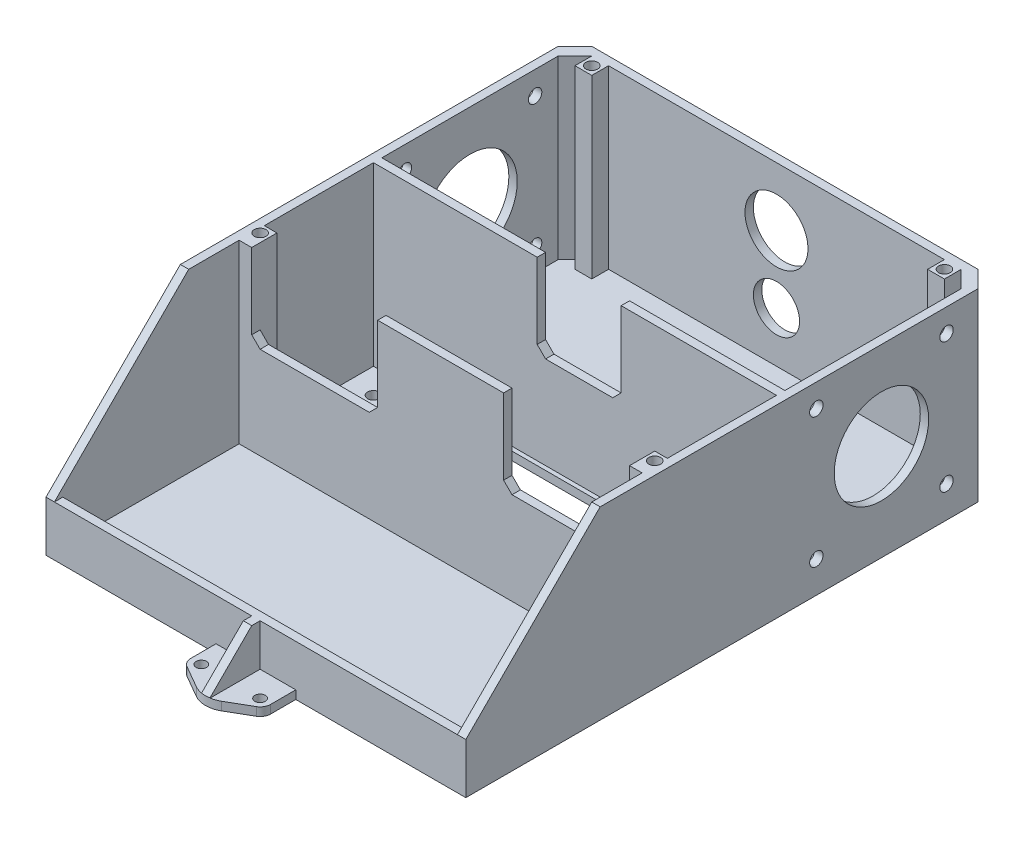
from build123d import *

# Parameters (mm, degrees)
SKETCH1_W               = 100
SKETCH1_H               = 126
BOSS_EXTRUDE1_DEPTH     = 2
SKETCH2_W               = 96
SKETCH2_H               = 2
BOSS_EXTRUDE2_DEPTH     = 42
CHAMFER1_SIZE           = 32
CHAMFER2_SIZE           = 4
CUT_EXTRUDE1_DEPTH      = 166.577776287
CUT_EXTRUDE1_DEPTH_BACK = 166.577776287
SKETCH4_R               = 11.25
SKETCH4_R_2             = 1.6
SKETCH5_R               = 1.4
SKETCH5_W               = 78
SKETCH5_H               = 28
CUT_EXTRUDE2_DEPTH      = 167.252819525
SKETCH6_W               = 96
SKETCH6_H               = 2
BOSS_EXTRUDE3_DEPTH     = 10
SKETCH9_W               = 4
SKETCH9_H               = 4
SKETCH9_W_2             = 3
BOSS_EXTRUDE5_DEPTH     = 42
SKETCH10_R              = 1.4
CUT_EXTRUDE4_DEPTH      = 10
SKETCH11_W              = 30
SKETCH11_H              = 2
SKETCH11_W_2            = 20
CUT_EXTRUDE5_DEPTH      = 20
CHAMFER4_SIZE           = 2
SKETCH12_R              = 5.5
SKETCH12_R_2            = 7.5
CUT_EXTRUDE6_DEPTH      = 2
SKETCH13_W              = 1
SKETCH13_H              = 10
BOSS_EXTRUDE6_DEPTH     = 12
CHAMFER5_SIZE           = 10
SKETCH14_R              = 1.25
CUT_EXTRUDE7_DEPTH      = 2.3


with BuildPart() as part:
    # Sketch1 → Boss-Extrude1 (new body)
    with BuildSketch(Plane(origin=(0, 0, 0), x_dir=(1, 0, 0), z_dir=(0, 1, 0))):
        with Locations((50, 63)):
            Rectangle(SKETCH1_W, SKETCH1_H)
    extrude(amount=BOSS_EXTRUDE1_DEPTH)

    # Sketch2 → Boss-Extrude2 (add)
    with BuildSketch(Plane(origin=(0, 2, 0), x_dir=(1, 0, 0), z_dir=(0, 1, 0))):
        Polygon((0, 126), (0, 0), (2, 0), (2, 44), (2, 46), (2, 76), (2, 78), (2, 124), (98, 124), (98, 78), (98, 76), (98, 46), (98, 44), (98, 0), (100, 0), (100, 126), align=None)
        with Locations((50, 77)):
            Rectangle(SKETCH2_W, SKETCH2_H)
        with Locations((50, 45)):
            Rectangle(SKETCH2_W, SKETCH2_H)
    extrude(amount=BOSS_EXTRUDE2_DEPTH)

    # Chamfer1
    chamfer1_edges = [part.edges().sort_by_distance(p)[0] for p in [
        (99, 44, 0),
        (1, 44, 0),
    ]]
    chamfer(chamfer1_edges, length=CHAMFER1_SIZE)

    # Chamfer2
    chamfer2_edges = [part.edges().sort_by_distance(p)[0] for p in [
        (2, 23, -124),
        (98, 23, -124),
        (0, 22, -126),
        (100, 22, -126),
    ]]
    chamfer(chamfer2_edges, length=CHAMFER2_SIZE)

    # Sketch4 → Cut-Extrude1 (cut, two sides: drawn at the far end of the back side and taken through both)
    with BuildSketch(Plane(origin=(2, 0, 0), x_dir=(0, 0, -1), z_dir=(1, 0, 0)).offset(-CUT_EXTRUDE1_DEPTH_BACK)):
        with Locations((99, 23)):
            Circle(SKETCH4_R)
        with Locations((83.5, 38.5)):
            Circle(SKETCH4_R_2)
        with Locations((114.5, 38.5)):
            Circle(SKETCH4_R_2)
        with Locations((114.5, 7.5)):
            Circle(SKETCH4_R_2)
        with Locations((83.5, 7.5)):
            Circle(SKETCH4_R_2)
    extrude(amount=CUT_EXTRUDE1_DEPTH + CUT_EXTRUDE1_DEPTH_BACK, mode=Mode.SUBTRACT)

    # Sketch5 → Cut-Extrude2 (cut, through all)
    with BuildSketch(Plane(origin=(0, 2, 0), x_dir=(1, 0, 0), z_dir=(0, 1, 0))):
        with Locations(Location((8, 70, 0), (0, 0, 270))):
            Circle(SKETCH5_R)
        with Locations(Location((8, 52, 0), (0, 0, 270))):
            Circle(SKETCH5_R)
        with Locations(Location((92, 70, 0), (0, 0, 270))):
            Circle(SKETCH5_R)
        with Locations(Location((92, 52, 0), (0, 0, 270))):
            Circle(SKETCH5_R)
        with Locations((50, 61)):
            Rectangle(SKETCH5_W, SKETCH5_H)
    extrude(amount=-CUT_EXTRUDE2_DEPTH, mode=Mode.SUBTRACT)

    # Sketch6 → Boss-Extrude3 (add)
    with BuildSketch(Plane(origin=(0, 2, 0), x_dir=(1, 0, 0), z_dir=(0, 1, 0))):
        with Locations((50, 1)):
            Rectangle(SKETCH6_W, SKETCH6_H)
    extrude(amount=BOSS_EXTRUDE3_DEPTH)

    # Sketch9 → Boss-Extrude5 (add)
    with BuildSketch(Plane(origin=(0, 2, 0), x_dir=(1, 0, 0), z_dir=(0, 1, 0))):
        with Locations((8, 122)):
            Rectangle(SKETCH9_W, SKETCH9_H)
        with Locations((92, 122)):
            Rectangle(SKETCH9_W, SKETCH9_H)
        with Locations((96.5, 48)):
            Rectangle(SKETCH9_W_2, SKETCH9_H)
        with Locations((3.5, 48)):
            Rectangle(SKETCH9_W_2, SKETCH9_H)
    extrude(amount=BOSS_EXTRUDE5_DEPTH)

    # Sketch10 → Cut-Extrude4 (cut)
    with BuildSketch(Plane(origin=(0, 44, 0), x_dir=(1, 0, 0), z_dir=(0, 1, 0))):
        with Locations(Location((3, 48, 0), (0, 0, 270))):
            Circle(SKETCH10_R)
        with Locations(Location((97, 48, 0), (0, 0, 270))):
            Circle(SKETCH10_R)
        with Locations(Location((92, 122, 0), (0, 0, 270))):
            Circle(SKETCH10_R)
        with Locations(Location((8, 122, 0), (0, 0, 270))):
            Circle(SKETCH10_R)
    extrude(amount=-CUT_EXTRUDE4_DEPTH, mode=Mode.SUBTRACT)

    # Sketch11 → Cut-Extrude5 (cut)
    with BuildSketch(Plane(origin=(0, 44, 0), x_dir=(1, 0, 0), z_dir=(0, 1, 0))):
        with Locations((80, 45)):
            Rectangle(SKETCH11_W, SKETCH11_H)
        with Locations((20, 45)):
            Rectangle(SKETCH11_W, SKETCH11_H)
        with Locations((51, 77)):
            Rectangle(SKETCH11_W_2, SKETCH11_H)
    extrude(amount=-CUT_EXTRUDE5_DEPTH, mode=Mode.SUBTRACT)

    # Chamfer4
    chamfer4_edges = [part.edges().sort_by_distance(p)[0] for p in [
        (41, 24, -77),
        (61, 24, -77),
        (95, 24, -45),
        (65, 24, -45),
        (5, 24, -45),
        (35, 24, -45),
    ]]
    chamfer(chamfer4_edges, length=CHAMFER4_SIZE)

    # Sketch12 → Cut-Extrude6 (cut)
    with BuildSketch(Plane(origin=(0, 0, -126), x_dir=(-1, 0, 0), z_dir=(0, 0, -1))):
        with Locations((-50, 14)):
            Circle(SKETCH12_R)
        with Locations((-50, 30)):
            Circle(SKETCH12_R_2)
    extrude(amount=-CUT_EXTRUDE6_DEPTH, mode=Mode.SUBTRACT)

    # Sketch13 → Boss-Extrude6 (add)
    with BuildSketch(Plane.XY):
        Polygon((51, 2), (50, 2), (50, 0), (59.5, 0), (59.5, 2), align=None)
        Polygon((50, 0), (50, 2), (49, 2), (40.5, 2), (40.5, 0), align=None)
        with Locations((50.5, 7)):
            Rectangle(SKETCH13_W, SKETCH13_H)
        with Locations((49.5, 7)):
            Rectangle(SKETCH13_W, SKETCH13_H)
    extrude(amount=BOSS_EXTRUDE6_DEPTH)

    # Chamfer5
    chamfer5_edges = [part.edges().sort_by_distance(p)[0] for p in [
        (50, 12, 12),
    ]]
    chamfer(chamfer5_edges, length=CHAMFER5_SIZE)

    # Sketch14 → Cut-Extrude7 (cut)
    with BuildSketch(Plane.XZ):
        with BuildLine():
            ThreePointArc((40.5, 6), (40.834936491, 7.25), (41.75, 8.165063509))
            Line((41.75, 8.165063509), (47, 11.196152423))
            ThreePointArc((47, 11.196152423), (48.447085729, 11.795554958), (50, 12))
            Line((50, 12), (40.5, 12))
            Line((40.5, 12), (40.5, 6))
        make_face()
        with BuildLine():
            Line((59.5, 12), (50, 12))
            ThreePointArc((50, 12), (51.552914271, 11.795554958), (53, 11.196152423))
            Line((53, 11.196152423), (58.25, 8.165063509))
            ThreePointArc((58.25, 8.165063509), (59.165063509, 7.25), (59.5, 6))
            Line((59.5, 6), (59.5, 12))
        make_face()
        with Locations(Location((57, 6, 0), (0, 0, 270))):
            Circle(SKETCH14_R)
        with Locations(Location((43, 6, 0), (0, 0, 270))):
            Circle(SKETCH14_R)
    extrude(amount=-CUT_EXTRUDE7_DEPTH, mode=Mode.SUBTRACT)


solid = part.part
